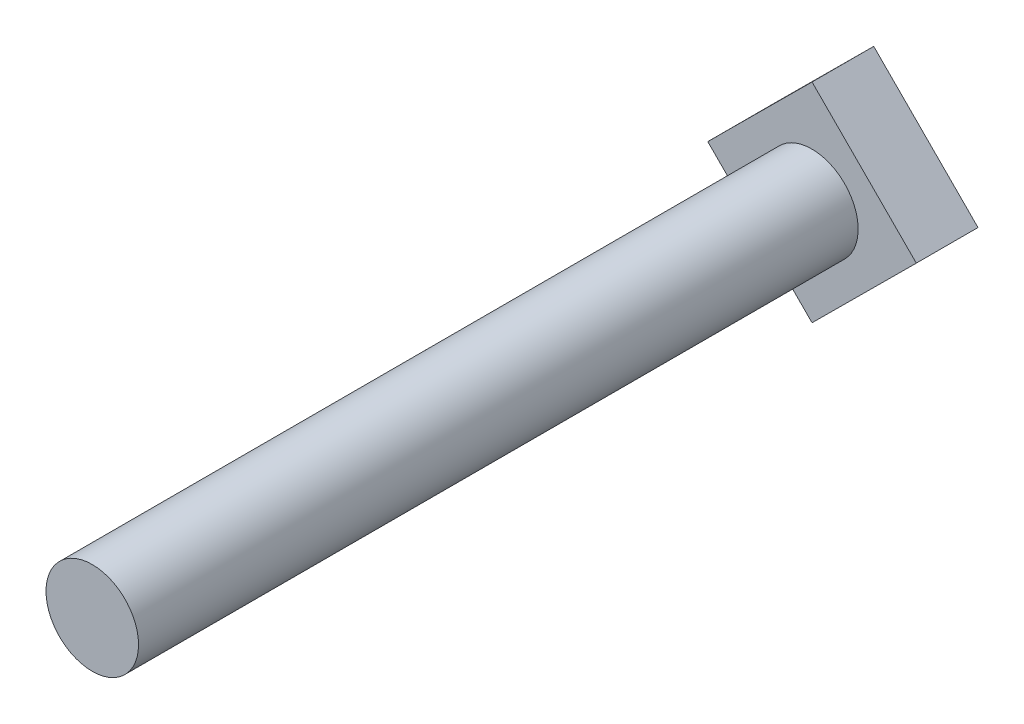
from build123d import *

# Parameters (mm, degrees)
ESQUISSE1_R        = 45
BOSS_EXTRU_8_DEPTH = 700
BOSS_EXTRU_9_START = 60
ESQUISSE6_R        = 45
BOSS_EXTRU_9_DEPTH = 60


with BuildPart() as part:
    # Esquisse1 → Boss.-Extru.8 (new body)
    with BuildSketch(Plane.XY):
        with Locations((-5.0559795, 0.208317709)):
            Circle(ESQUISSE1_R)
    extrude(amount=BOSS_EXTRU_8_DEPTH)

    # Esquisse6 → Boss.-Extru.9 (add)
    # profile 1 of 4: a face of its own
    with BuildSketch(Plane(origin=(0, 0, 0), x_dir=(-1, 0, 0), z_dir=(0, 0, -1)).offset(BOSS_EXTRU_9_START)):
        Polygon((4.92504327, 101.776708668), (106.333278208, 0.8368395), (4.896305663, -101.070805399), (-96.511929276, -0.13093623), align=None)
        with Locations((5.0559795, 0.208317709)):
            Circle(ESQUISSE6_R, mode=Mode.SUBTRACT)
    # profile 2 of 4: a face of its own
    with BuildSketch(Plane(origin=(0, 0, 0), x_dir=(-1, 0, 0), z_dir=(0, 0, -1)).offset(BOSS_EXTRU_9_START)):
        Polygon((5.0559795, 45.208317709), (49.764887249, 0.705903269), (4.765369432, -44.50241444), (-39.943538316, 0), align=None)
    # profile 3 of 4: a face of its own
    with BuildSketch(Plane(origin=(0, 0, 0), x_dir=(-1, 0, 0), z_dir=(0, 0, -1)).offset(BOSS_EXTRU_9_START)):
        with BuildLine():
            ThreePointArc((50.0559795, 0.208317709), (36.875784654, 32.028122862), (5.0559795, 45.208317709))
            Line((5.0559795, 45.208317709), (49.764887249, 0.705903269))
            Line((49.764887249, 0.705903269), (4.765369432, -44.50241444))
            Line((4.765369432, -44.50241444), (-39.943538316, 0))
            ThreePointArc((-39.943538316, 0), (5.160138634, -44.791561745), (50.0559795, 0.208317709))
        make_face()
    # profile 4 of 4: a face of its own
    with BuildSketch(Plane(origin=(0, 0, 0), x_dir=(-1, 0, 0), z_dir=(0, 0, -1)).offset(BOSS_EXTRU_9_START)):
        with BuildLine():
            Line((-39.943538316, 0), (5.0559795, 45.208317709))
            ThreePointArc((5.0559795, 45.208317709), (-26.837392044, 31.954385994), (-39.943538316, 0))
        make_face()
    extrude(amount=-BOSS_EXTRU_9_DEPTH)


solid = part.part
